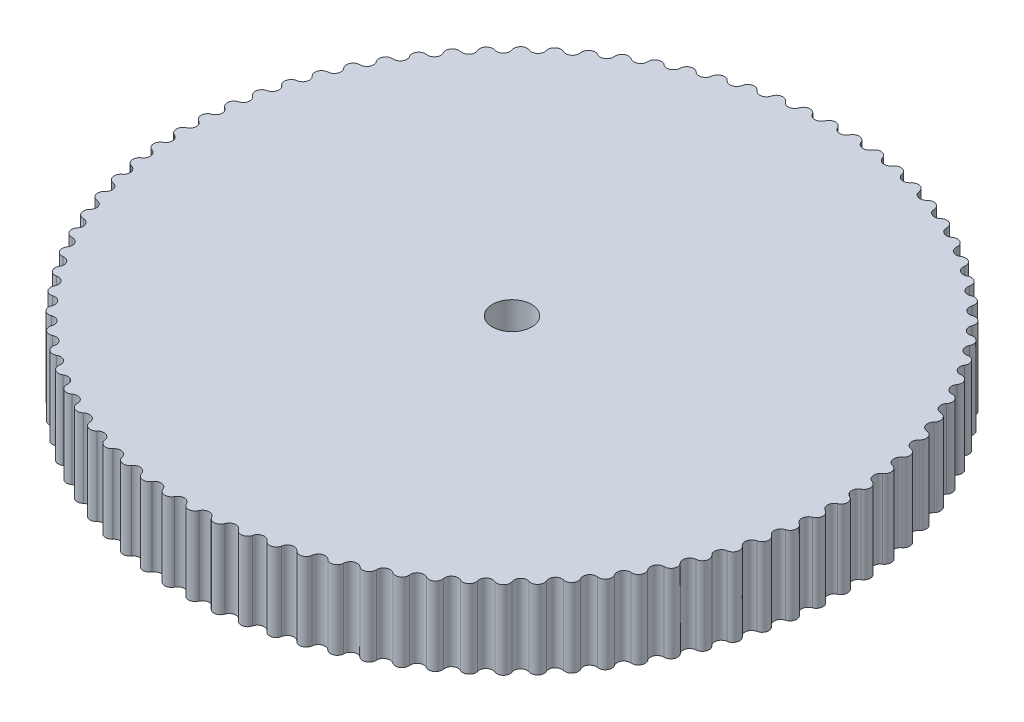
from build123d import *

# Parameters (mm, degrees)
BOSS_EXTRUDE1_DEPTH = 20
CIRPATTERN1_COUNT   = 84


with BuildPart() as part:
    # Sketch1 → Boss-Extrude1 (new body)
    with BuildSketch(Plane(origin=(0, 0, 0), x_dir=(1, 0, 0), z_dir=(0, 1, 0))):
        with BuildLine():
            Line((0, 83), (0, 5))
            ThreePointArc((0, 5), (0.186955971, 4.996503524), (0.373650468, 4.986018986))
            Line((0.373650468, 4.986018986), (6.202597768, 82.767915166))
            ThreePointArc((6.202597768, 82.767915166), (4.709917568, 83.867852461), (3.103469125, 82.941958497))
            ThreePointArc((3.103469125, 82.941958497), (1.533307047, 81.985663195), (0, 83))
        make_face()
    boss_extrude1 = extrude(amount=BOSS_EXTRUDE1_DEPTH)

    # CirPattern1: Boss-Extrude1 ×84 about axis
    cirpattern1_axis = Axis((0, 0, 0), (0, 1, 0))
    for i in range(1, CIRPATTERN1_COUNT):
        add(boss_extrude1.rotate(cirpattern1_axis, i * 360 / CIRPATTERN1_COUNT))


solid = part.part
